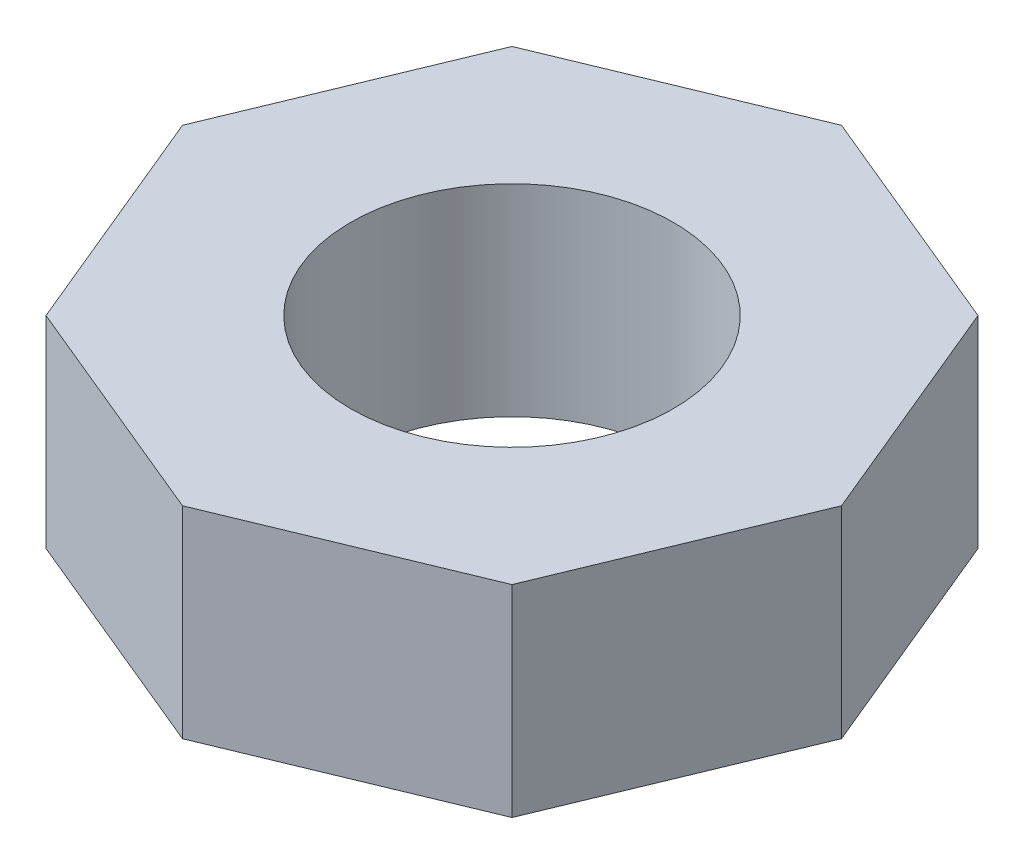
from build123d import *

# Parameters (mm, degrees)
SKETCH1_R           = 1.6
BOSS_EXTRUDE1_DEPTH = 2


with BuildPart() as part:
    # Sketch1 → Boss-Extrude1 (new body)
    with BuildSketch(Plane(origin=(0, 0, 0), x_dir=(1, 0, 0), z_dir=(0, 1, 0))):
        Polygon((3.266407412, 0), (2.309698831, 2.309698831), (0, 3.266407412), (-2.309698831, 2.309698831), (-3.266407412, 0), (-2.309698831, -2.309698831), (0, -3.266407412), (2.309698831, -2.309698831), align=None)
        with Locations(Location((0, 0, 0), (0, 0, 270))):
            Circle(SKETCH1_R, mode=Mode.SUBTRACT)
    extrude(amount=BOSS_EXTRUDE1_DEPTH)


solid = part.part
